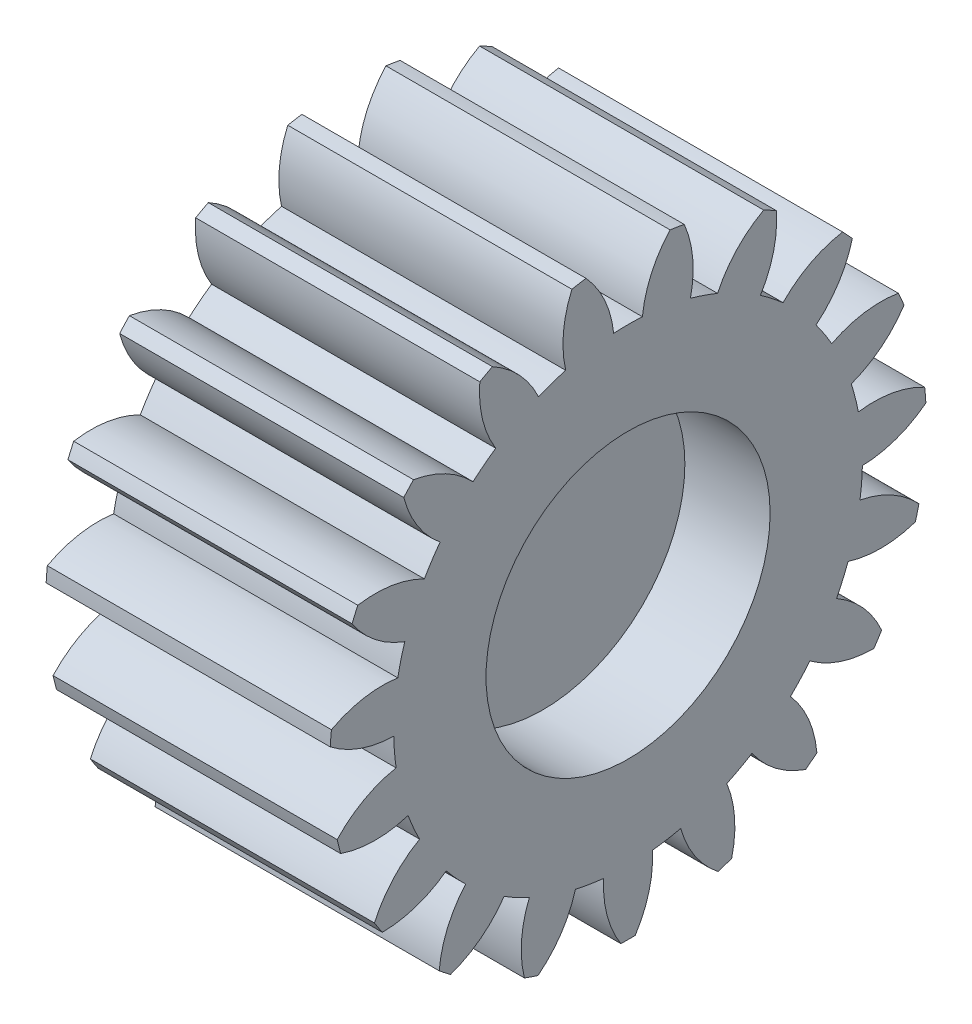
from build123d import *
from build123d.topology import SkipClean

# Parameters (mm, degrees)
BASPROSKE_W         = 12
BASPROSKE_H         = 10.5
TOOTHCUT_DEPTH      = 20.091883092
TEETHCUTS_COUNT     = 19
BORSKE_R            = 2.5
BORE_DEPTH          = 50.0000508
SKETCH1_R           = 5
CUT_EXTRUDE1_DEPTH  = 3
BOSS_EXTRUDE1_DEPTH = 9
SKETCH3_R           = 10.5
SKETCH3_R_2         = 8.249
CUT_EXTRUDE2_DEPTH  = 2
SKETCH4_R           = 8.249
CUT_EXTRUDE3_DEPTH  = 2
BOSS_EXTRUDE3_START = -7
SKETCH5_R           = 2.5
BOSS_EXTRUDE3_DEPTH = 7


with BuildPart() as part:
    # BasProSke → Base-Revolve (revolve)
    with BuildSketch(Plane(origin=(0, 0, 0), x_dir=(1, 0, 0), z_dir=(0, 1, 0)), mode=Mode.PRIVATE) as base_revolve_sk:
        with Locations((6, 5.25)):
            Rectangle(BASPROSKE_W, BASPROSKE_H)
    revolve(base_revolve_sk.sketch.rotate(Axis((-10, 0, 0), (1, 0, 0)), 180), axis=Axis((-10, 0, 0), (1, 0, 0)))

    # TooCutSke → ToothCut (cut, through all)
    with BuildSketch(Plane(origin=(0, 0, 0), x_dir=(0, 0, -1), z_dir=(1, 0, 0))):
        with BuildLine():
            ThreePointArc((0.505024765, 8.233526036), (0, 8.249), (-0.505024765, 8.233526036))
            ThreePointArc((-0.505024765, 8.233526036), (-0.825185426, 9.406360648), (-1.499357972, 10.41805984))
            ThreePointArc((-1.499357972, 10.41805984), (0, 10.5254), (1.499357972, 10.41805984))
            ThreePointArc((1.499357972, 10.41805984), (0.825185426, 9.406360648), (0.505024765, 8.233526036))
        make_face()
    toothcut = extrude(amount=TOOTHCUT_DEPTH, mode=Mode.SUBTRACT)

    # TeethCuts: ToothCut ×19 about axis
    teethcuts_axis = Axis((0, 0, 0), (1, 0, 0))
    for i in range(1, TEETHCUTS_COUNT):
        add(toothcut.rotate(teethcuts_axis, i * 360 / TEETHCUTS_COUNT), mode=Mode.SUBTRACT)

    # BorSke → Bore (cut, symmetric)
    with BuildSketch(Plane(origin=(0, 0, 0), x_dir=(0, 0, -1), z_dir=(1, 0, 0))):
        with Locations(Location((0, 0, 0), (0, 0, 180))):
            Circle(BORSKE_R)
    extrude(amount=BORE_DEPTH, both=True, mode=Mode.SUBTRACT)

    # Sketch1 → Cut-Extrude1 (cut)
    with BuildSketch(Plane(origin=(12, 0, 0), x_dir=(0, 0, -1), z_dir=(1, 0, 0))):
        Circle(SKETCH1_R)
    extrude(amount=-CUT_EXTRUDE1_DEPTH, mode=Mode.SUBTRACT)

    # Sketch2 → Boss-Extrude1 (add)
    with BuildSketch(Plane(origin=(9, 0, 0), x_dir=(0, 0, -1), z_dir=(1, 0, 0))):
        with BuildLine():
            Line((-2.085372664, -1.378847653), (-2.085372664, 1.378847653))
            ThreePointArc((-2.085372664, 1.378847653), (-2.5, 0), (-2.085372664, -1.378847653))
        make_face()
    extrude(amount=-BOSS_EXTRUDE1_DEPTH)

    # Sketch3 → Cut-Extrude2 (cut)
    with SkipClean():  # the faces are left unmerged after this step: merging them gives an invalid solid
        with BuildSketch(Plane.ZY):
            Circle(SKETCH3_R)
            with Locations(Location((0, 0, 0), (0, 0, 358.773146294))):
                Circle(SKETCH3_R_2, mode=Mode.SUBTRACT)
        extrude(amount=-CUT_EXTRUDE2_DEPTH, mode=Mode.SUBTRACT)

    # Sketch4 → Cut-Extrude3 (cut)
    with BuildSketch(Plane.ZY):
        Circle(SKETCH4_R)
    extrude(amount=-CUT_EXTRUDE3_DEPTH, mode=Mode.SUBTRACT)

    # Sketch5 → Boss-Extrude3 (add)
    with BuildSketch(Plane.ZY.offset(-2).offset(BOSS_EXTRUDE3_START)):
        Circle(SKETCH5_R)
    extrude(amount=BOSS_EXTRUDE3_DEPTH)


solid = part.part
